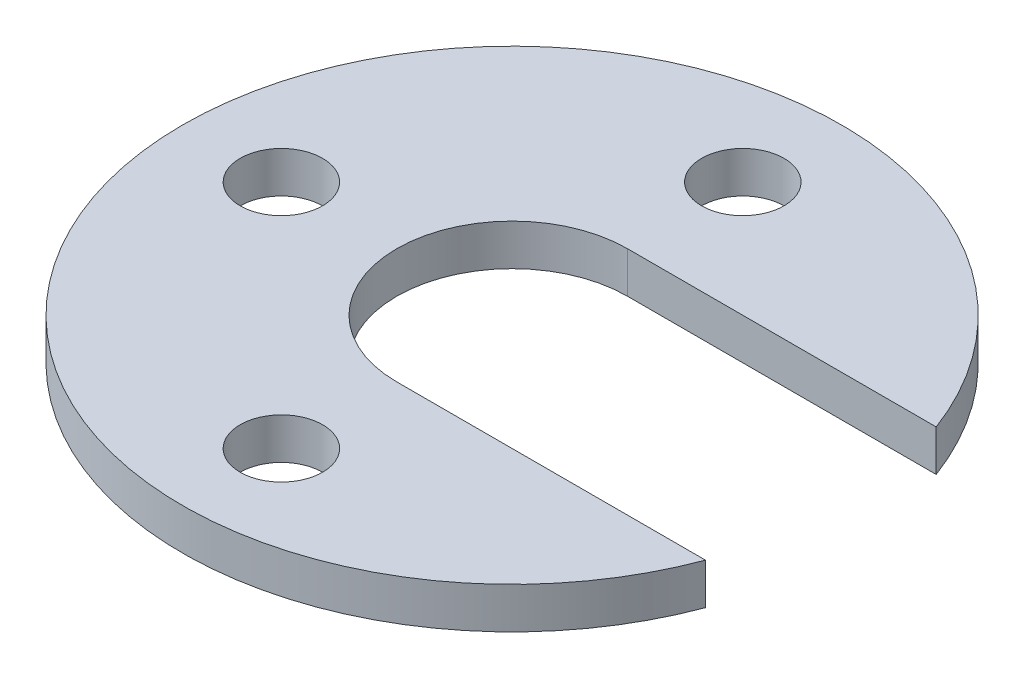
from build123d import *

# Parameters (mm, degrees)
SKETCH1_R           = 5
BOSS_EXTRUDE1_DEPTH = 5


with BuildPart() as part:
    # Sketch1 → Boss-Extrude1 (new body)
    with BuildSketch(Plane(origin=(0, 0, 0), x_dir=(1, 0, 0), z_dir=(0, 1, 0))):
        with BuildLine():
            Line((0, 14), (37.46998799, 14))
            ThreePointArc((37.46998799, 14), (-40, 0), (37.46998799, -14))
            Line((37.46998799, -14), (0, -14))
            ThreePointArc((0, -14), (-14, 0), (0, 14))
        make_face()
        with Locations(Location((0, 28, 0), (0, 0, 270))):
            Circle(SKETCH1_R, mode=Mode.SUBTRACT)
        with Locations(Location((0, -28, 0), (0, 0, 270))):
            Circle(SKETCH1_R, mode=Mode.SUBTRACT)
        with Locations(Location((-28, 0, 0), (0, 0, 270))):
            Circle(SKETCH1_R, mode=Mode.SUBTRACT)
    extrude(amount=BOSS_EXTRUDE1_DEPTH)


solid = part.part
